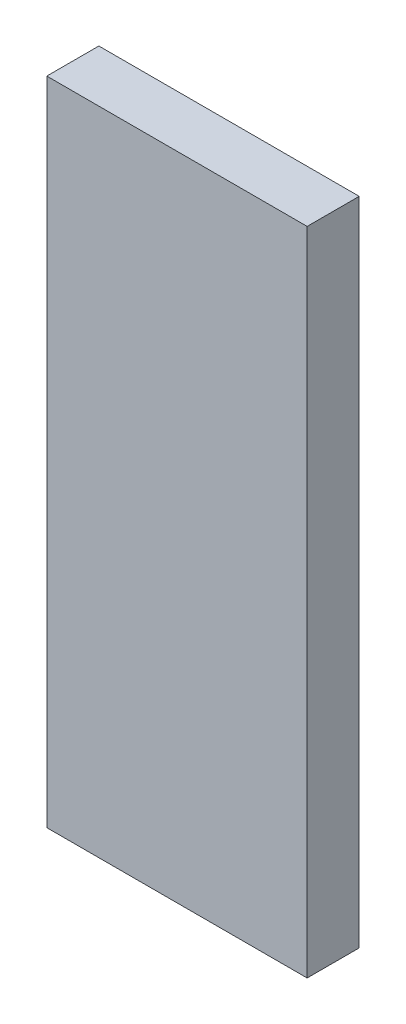
from build123d import *

# Parameters (mm, degrees)
SKETCH1_W           = 40
SKETCH1_H           = 8
BOSS_EXTRUDE1_DEPTH = 100


with BuildPart() as part:
    # Sketch1 → Boss-Extrude1 (new body)
    with BuildSketch(Plane(origin=(0, 0, 0), x_dir=(1, 0, 0), z_dir=(0, 1, 0))):
        Rectangle(SKETCH1_W, SKETCH1_H)
    extrude(amount=BOSS_EXTRUDE1_DEPTH)


solid = part.part
